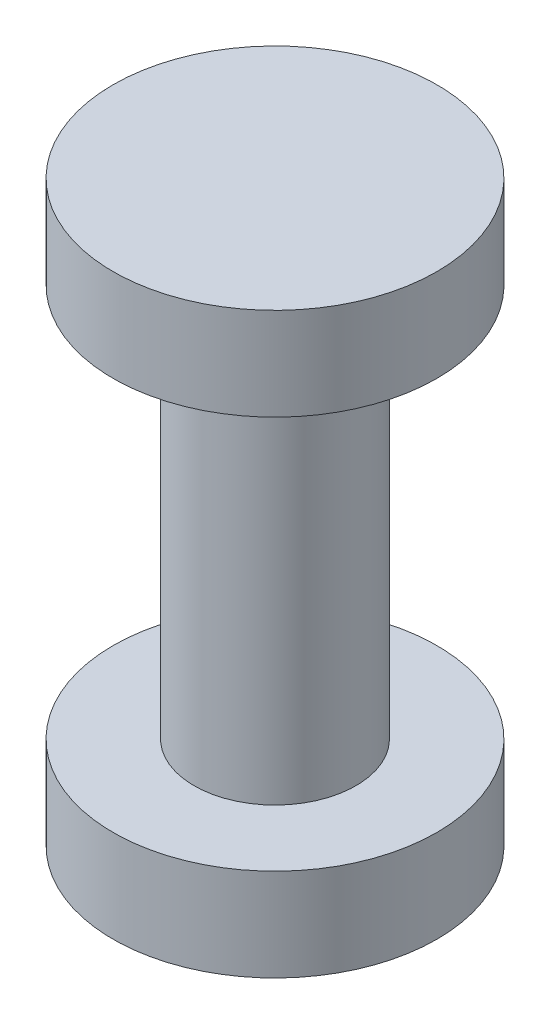
from build123d import *


with BuildPart() as part:
    # Sketch1 → Revolve1 (revolve)
    with BuildSketch(Plane.XY, mode=Mode.PRIVATE) as revolve1_sk:
        Polygon((0, 0), (1778, 0), (1778, -1016), (889, -1016), (889, -5334), (1778, -5334), (1778, -6350), (0, -6350), (0, -5334), (0, -1016), align=None)
    revolve(revolve1_sk.sketch.rotate(Axis((0, -1016, 0), (0, -1, 0)), 180), axis=Axis((0, -1016, 0), (0, -1, 0)))


solid = part.part
